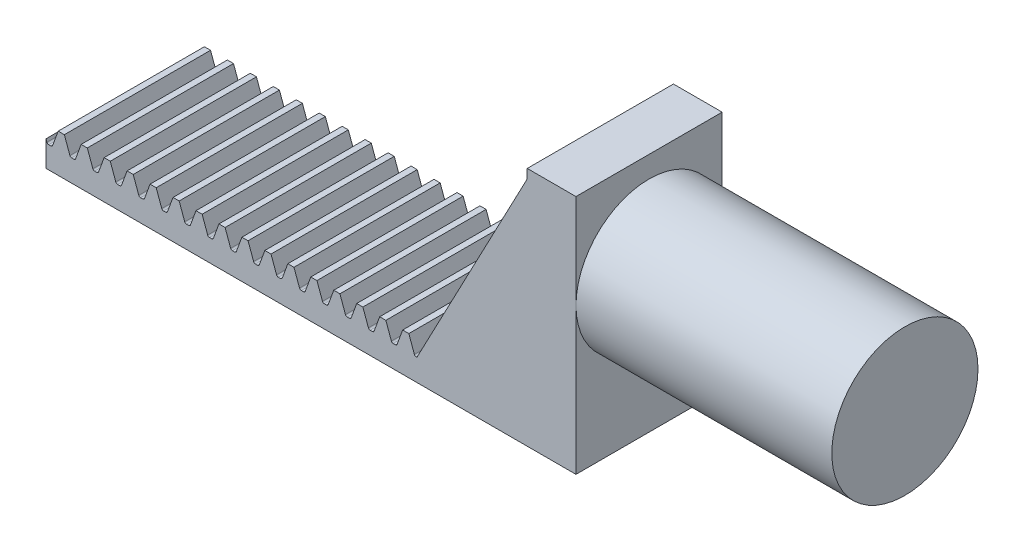
from build123d import *

# Parameters (mm, degrees)
BOSS_EXTRUDE1_DEPTH = 20
SCALE1_SCALE        = 0.3
BOSS_EXTRUDE5_DEPTH = 12
BOSS_EXTRUDE2_DEPTH = 4
SKETCH5_R           = 6
BOSS_EXTRUDE3_DEPTH = 21
SKETCH10_W          = 7.23
SKETCH10_H          = 3.15
CUT_EXTRUDE1_DEPTH  = 12


with BuildPart() as part:
    # Sketch1 → Boss-Extrude1 (new, symmetric)
    with BuildSketch(Plane.XY.offset(19)):
        with BuildLine():
            Line((0, -23.5), (0, -29.5))
            Line((0, -29.5), (131.946891451, -29.5))
            Line((131.946891451, -29.5), (131.946891451, -23.5))
            Line((131.946891451, -23.5), (131.636124479, -23.5))
            ThreePointArc((131.636124479, -23.5), (131.349336261, -23.409576022), (131.166278168, -23.171010072))
            Line((131.166278168, -23.171010072), (129.648154655, -19))
            Line((129.648154655, -19), (127.962442939, -19))
            Line((127.962442939, -19), (126.444319426, -23.171010072))
            ThreePointArc((126.444319426, -23.171010072), (126.261261334, -23.409576022), (125.974473116, -23.5))
            Line((125.974473116, -23.5), (125.352939172, -23.5))
            ThreePointArc((125.352939172, -23.5), (125.066150953, -23.409576022), (124.883092861, -23.171010072))
            Line((124.883092861, -23.171010072), (123.364969348, -19))
            Line((123.364969348, -19), (121.679257632, -19))
            Line((121.679257632, -19), (120.161134119, -23.171010072))
            ThreePointArc((120.161134119, -23.171010072), (119.978076027, -23.409576022), (119.691287808, -23.5))
            Line((119.691287808, -23.5), (119.069753864, -23.5))
            ThreePointArc((119.069753864, -23.5), (118.782965646, -23.409576022), (118.599907554, -23.171010072))
            Line((118.599907554, -23.171010072), (117.081784041, -19))
            Line((117.081784041, -19), (115.396072325, -19))
            Line((115.396072325, -19), (113.877948812, -23.171010072))
            ThreePointArc((113.877948812, -23.171010072), (113.694890719, -23.409576022), (113.408102501, -23.5))
            Line((113.408102501, -23.5), (112.786568557, -23.5))
            ThreePointArc((112.786568557, -23.5), (112.499780339, -23.409576022), (112.316722247, -23.171010072))
            Line((112.316722247, -23.171010072), (110.798598734, -19))
            Line((110.798598734, -19), (109.112887017, -19))
            Line((109.112887017, -19), (107.594763504, -23.171010072))
            ThreePointArc((107.594763504, -23.171010072), (107.411705412, -23.409576022), (107.124917194, -23.5))
            Line((107.124917194, -23.5), (106.50338325, -23.5))
            ThreePointArc((106.50338325, -23.5), (106.216595032, -23.409576022), (106.03353694, -23.171010072))
            Line((106.03353694, -23.171010072), (104.515413427, -19))
            Line((104.515413427, -19), (102.82970171, -19))
            Line((102.82970171, -19), (101.311578197, -23.171010072))
            ThreePointArc((101.311578197, -23.171010072), (101.128520105, -23.409576022), (100.841731887, -23.5))
            Line((100.841731887, -23.5), (100.220197943, -23.5))
            ThreePointArc((100.220197943, -23.5), (99.933409725, -23.409576022), (99.750351632, -23.171010072))
            Line((99.750351632, -23.171010072), (98.23222812, -19))
            Line((98.23222812, -19), (96.546516403, -19))
            Line((96.546516403, -19), (95.02839289, -23.171010072))
            ThreePointArc((95.02839289, -23.171010072), (94.845334798, -23.409576022), (94.55854658, -23.5))
            Line((94.55854658, -23.5), (93.937012636, -23.5))
            ThreePointArc((93.937012636, -23.5), (93.650224417, -23.409576022), (93.467166325, -23.171010072))
            Line((93.467166325, -23.171010072), (91.949042812, -19))
            Line((91.949042812, -19), (90.263331096, -19))
            Line((90.263331096, -19), (88.745207583, -23.171010072))
            ThreePointArc((88.745207583, -23.171010072), (88.562149491, -23.409576022), (88.275361273, -23.5))
            Line((88.275361273, -23.5), (87.653827328, -23.5))
            ThreePointArc((87.653827328, -23.5), (87.36703911, -23.409576022), (87.183981018, -23.171010072))
            Line((87.183981018, -23.171010072), (85.665857505, -19))
            Line((85.665857505, -19), (83.980145789, -19))
            Line((83.980145789, -19), (82.462022276, -23.171010072))
            ThreePointArc((82.462022276, -23.171010072), (82.278964184, -23.409576022), (81.992175965, -23.5))
            Line((81.992175965, -23.5), (81.370642021, -23.5))
            ThreePointArc((81.370642021, -23.5), (81.083853803, -23.409576022), (80.900795711, -23.171010072))
            Line((80.900795711, -23.171010072), (79.382672198, -19))
            Line((79.382672198, -19), (77.696960481, -19))
            Line((77.696960481, -19), (76.178836969, -23.171010072))
            ThreePointArc((76.178836969, -23.171010072), (75.995778876, -23.409576022), (75.708990658, -23.5))
            Line((75.708990658, -23.5), (75.087456714, -23.5))
            ThreePointArc((75.087456714, -23.5), (74.800668496, -23.409576022), (74.617610404, -23.171010072))
            Line((74.617610404, -23.171010072), (73.099486891, -19))
            Line((73.099486891, -19), (71.413775174, -19))
            Line((71.413775174, -19), (69.895651661, -23.171010072))
            ThreePointArc((69.895651661, -23.171010072), (69.712593569, -23.409576022), (69.425805351, -23.5))
            Line((69.425805351, -23.5), (68.804271407, -23.5))
            ThreePointArc((68.804271407, -23.5), (68.517483189, -23.409576022), (68.334425097, -23.171010072))
            Line((68.334425097, -23.171010072), (66.816301584, -19))
            Line((66.816301584, -19), (65.130589867, -19))
            Line((65.130589867, -19), (63.612466354, -23.171010072))
            ThreePointArc((63.612466354, -23.171010072), (63.429408262, -23.409576022), (63.142620044, -23.5))
            Line((63.142620044, -23.5), (62.5210861, -23.5))
            ThreePointArc((62.5210861, -23.5), (62.234297882, -23.409576022), (62.051239789, -23.171010072))
            Line((62.051239789, -23.171010072), (60.533116276, -19))
            Line((60.533116276, -19), (58.84740456, -19))
            Line((58.84740456, -19), (57.329281047, -23.171010072))
            ThreePointArc((57.329281047, -23.171010072), (57.146222955, -23.409576022), (56.859434737, -23.5))
            Line((56.859434737, -23.5), (56.237900793, -23.5))
            ThreePointArc((56.237900793, -23.5), (55.951112574, -23.409576022), (55.768054482, -23.171010072))
            Line((55.768054482, -23.171010072), (54.249930969, -19))
            Line((54.249930969, -19), (52.564219253, -19))
            Line((52.564219253, -19), (51.04609574, -23.171010072))
            ThreePointArc((51.04609574, -23.171010072), (50.863037648, -23.409576022), (50.576249429, -23.5))
            Line((50.576249429, -23.5), (49.954715485, -23.5))
            ThreePointArc((49.954715485, -23.5), (49.667927267, -23.409576022), (49.484869175, -23.171010072))
            Line((49.484869175, -23.171010072), (47.966745662, -19))
            Line((47.966745662, -19), (46.281033946, -19))
            Line((46.281033946, -19), (44.762910433, -23.171010072))
            ThreePointArc((44.762910433, -23.171010072), (44.57985234, -23.409576022), (44.293064122, -23.5))
            Line((44.293064122, -23.5), (43.671530178, -23.5))
            ThreePointArc((43.671530178, -23.5), (43.38474196, -23.409576022), (43.201683868, -23.171010072))
            Line((43.201683868, -23.171010072), (41.683560355, -19))
            Line((41.683560355, -19), (39.997848638, -19))
            Line((39.997848638, -19), (38.479725125, -23.171010072))
            ThreePointArc((38.479725125, -23.171010072), (38.296667033, -23.409576022), (38.009878815, -23.5))
            Line((38.009878815, -23.5), (37.388344871, -23.5))
            ThreePointArc((37.388344871, -23.5), (37.101556653, -23.409576022), (36.918498561, -23.171010072))
            Line((36.918498561, -23.171010072), (35.400375048, -19))
            Line((35.400375048, -19), (33.714663331, -19))
            Line((33.714663331, -19), (32.196539818, -23.171010072))
            ThreePointArc((32.196539818, -23.171010072), (32.013481726, -23.409576022), (31.726693508, -23.5))
            Line((31.726693508, -23.5), (31.105159564, -23.5))
            ThreePointArc((31.105159564, -23.5), (30.818371346, -23.409576022), (30.635313253, -23.171010072))
            Line((30.635313253, -23.171010072), (29.117189741, -19))
            Line((29.117189741, -19), (27.431478024, -19))
            Line((27.431478024, -19), (25.913354511, -23.171010072))
            ThreePointArc((25.913354511, -23.171010072), (25.730296419, -23.409576022), (25.443508201, -23.5))
            Line((25.443508201, -23.5), (24.821974257, -23.5))
            ThreePointArc((24.821974257, -23.5), (24.535186039, -23.409576022), (24.352127946, -23.171010072))
            Line((24.352127946, -23.171010072), (22.834004433, -19))
            Line((22.834004433, -19), (21.148292717, -19))
            Line((21.148292717, -19), (19.630169204, -23.171010072))
            ThreePointArc((19.630169204, -23.171010072), (19.447111112, -23.409576022), (19.160322894, -23.5))
            Line((19.160322894, -23.5), (18.53878895, -23.5))
            ThreePointArc((18.53878895, -23.5), (18.252000731, -23.409576022), (18.068942639, -23.171010072))
            Line((18.068942639, -23.171010072), (16.550819126, -19))
            Line((16.550819126, -19), (14.86510741, -19))
            Line((14.86510741, -19), (13.346983897, -23.171010072))
            ThreePointArc((13.346983897, -23.171010072), (13.163925805, -23.409576022), (12.877137586, -23.5))
            Line((12.877137586, -23.5), (12.255603642, -23.5))
            ThreePointArc((12.255603642, -23.5), (11.968815424, -23.409576022), (11.785757332, -23.171010072))
            Line((11.785757332, -23.171010072), (10.267633819, -19))
            Line((10.267633819, -19), (8.581922103, -19))
            Line((8.581922103, -19), (7.06379859, -23.171010072))
            ThreePointArc((7.06379859, -23.171010072), (6.880740497, -23.409576022), (6.593952279, -23.5))
            Line((6.593952279, -23.5), (5.972418335, -23.5))
            ThreePointArc((5.972418335, -23.5), (5.685630117, -23.409576022), (5.502572025, -23.171010072))
            Line((5.502572025, -23.171010072), (3.984448512, -19))
            Line((3.984448512, -19), (2.298736795, -19))
            Line((2.298736795, -19), (0.780613282, -23.171010072))
            ThreePointArc((0.780613282, -23.171010072), (0.59755519, -23.409576022), (0.310766972, -23.5))
            Line((0.310766972, -23.5), (0, -23.5))
        make_face()
    extrude(amount=BOSS_EXTRUDE1_DEPTH, both=True)


with BuildPart() as part_1:
    # Scale1: scaled about (65.973445725, -25.112352152, 19)
    add(part.part.scale(SCALE1_SCALE).moved(Location((46.181412008, -17.578646506, 13.3))))

    # Sketch8 → Boss-Extrude5 (add)
    with BuildSketch(Plane.XY.offset(25)):
        Polygon((82.912250153, -26.428646507), (92.912250153, -26.428646507), (92.912250153, -7.428646507), align=None)
    extrude(amount=-BOSS_EXTRUDE5_DEPTH)

    # Sketch4 → Boss-Extrude2 (add)
    with BuildSketch(Plane(origin=(92.912250153, 0, 0), x_dir=(0, 0, -1), z_dir=(1, 0, 0))):
        Polygon((-13, -26.428646507), (-13, -14.428646507), (-13, -6.678646507), (-25, -6.678646507), (-25, -14.428646507), (-25, -26.428646507), align=None)
    extrude(amount=BOSS_EXTRUDE2_DEPTH)

    # Sketch5 → Boss-Extrude3 (add)
    with BuildSketch(Plane(origin=(96.912250153, 0, 0), x_dir=(0, 0, -1), z_dir=(1, 0, 0))):
        with Locations((-19, -14.428646507)):
            Circle(SKETCH5_R)
    extrude(amount=BOSS_EXTRUDE3_DEPTH)

    # Sketch10 → Cut-Extrude1 (cut)
    with BuildSketch(Plane.XY.offset(25)):
        with Locations((49.796412008, -24.853646507)):
            Rectangle(SKETCH10_W, SKETCH10_H)
    extrude(amount=-CUT_EXTRUDE1_DEPTH, mode=Mode.SUBTRACT)


solid = part_1.part
